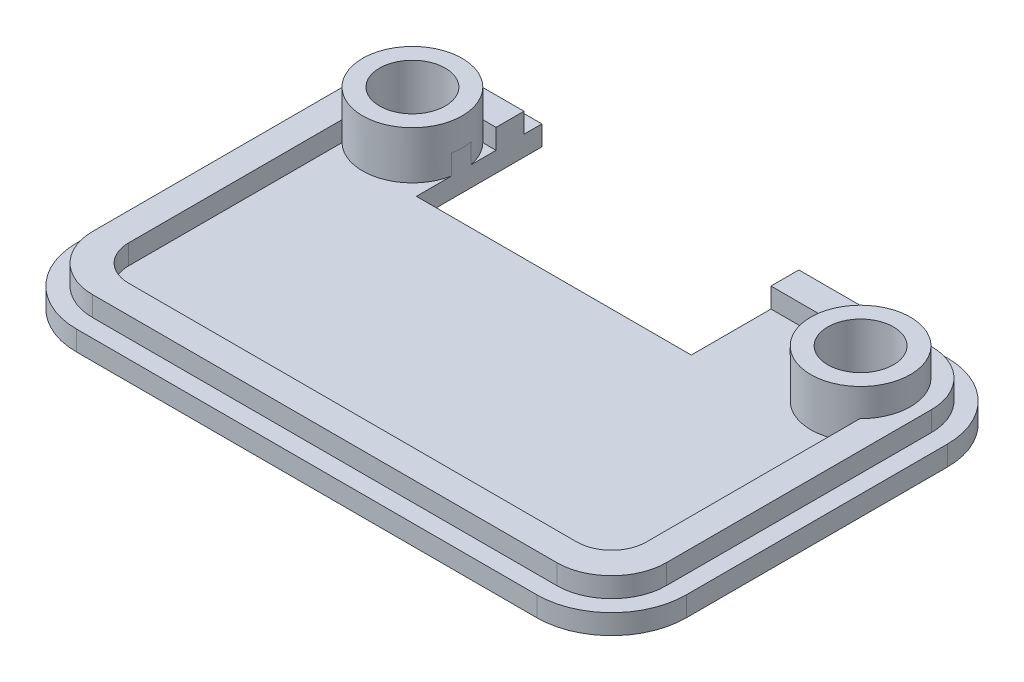
from build123d import *
from build123d.topology import SkipClean

# Parameters (mm, degrees)
SKETCH_1_W          = 30.6
SKETCH_1_H          = 20.6
EXTRUDE_1_DEPTH     = 1
SKETCH_2_W          = 28.8
SKETCH_2_H          = 18.8
SKETCH_2_W_2        = 26
SKETCH_2_H_2        = 16
EXTRUDE_2_DEPTH     = 1
SKETCH_3_R          = 2.5
SKETCH_3_R_2        = 1.65
EXTRUDE_3_DEPTH     = 2.4
FILLET_2_R          = 2.75
FILLET_3_R          = 3.75
FILLET_4_R          = 1.75
SKETCH_5_R          = 1.65
SKETCH_5_W          = 13.8
SKETCH_5_H          = 6.3
CUT_EXTRUDE_1_DEPTH = 2


with BuildPart() as part:
    # 草图1 → 凸台-拉伸1 (new body)
    with BuildSketch(Plane(origin=(0, 0, 0), x_dir=(1, 0, 0), z_dir=(0, 1, 0))):
        Rectangle(SKETCH_1_W, SKETCH_1_H)
    extrude(amount=EXTRUDE_1_DEPTH)

    # 草图2 → 凸台-拉伸2 (add)
    with BuildSketch(Plane(origin=(0, 1, 0), x_dir=(1, 0, 0), z_dir=(0, 1, 0))):
        Rectangle(SKETCH_2_W, SKETCH_2_H)
        Rectangle(SKETCH_2_W_2, SKETCH_2_H_2, mode=Mode.SUBTRACT)
    extrude(amount=EXTRUDE_2_DEPTH)

    # 草图3 → 凸台-拉伸3 (add)
    # profile 1 of 2: a face of its own
    with BuildSketch(Plane(origin=(0, 1, 0), x_dir=(1, 0, 0), z_dir=(0, 1, 0))):
        with Locations(Location((-11.25, 6.25, 0), (0, 0, 44.427004001))):
            Circle(SKETCH_3_R)
        with Locations(Location((-11.25, 6.25, 0), (0, 0, 270))):
            Circle(SKETCH_3_R_2, mode=Mode.SUBTRACT)
    # profile 2 of 2: a face of its own
    with BuildSketch(Plane(origin=(0, 1, 0), x_dir=(1, 0, 0), z_dir=(0, 1, 0))):
        with Locations(Location((11.25, 6.25, 0), (0, 0, 135.572995999))):
            Circle(SKETCH_3_R)
        with Locations(Location((11.25, 6.25, 0), (0, 0, 270))):
            Circle(SKETCH_3_R_2, mode=Mode.SUBTRACT)
    extrude(amount=EXTRUDE_3_DEPTH)

    # 圆角2
    fillet_2_edges = [part.edges().sort_by_distance(p)[0] for p in [
        (-14.4, 1.5, -9.4),
        (-14.4, 1.5, 9.4),
        (14.4, 1.5, 9.4),
        (14.4, 1.5, -9.4),
    ]]
    fillet(fillet_2_edges, radius=FILLET_2_R)

    # 圆角3
    fillet_3_edges = [part.edges().sort_by_distance(p)[0] for p in [
        (-15.3, 0.5, -10.3),
        (15.3, 0.5, -10.3),
        (15.3, 0.5, 10.3),
        (-15.3, 0.5, 10.3),
    ]]
    fillet(fillet_3_edges, radius=FILLET_3_R)

    # 圆角4
    fillet_4_edges = [part.edges().sort_by_distance(p)[0] for p in [
        (-13, 1.5, 8),
        (13, 1.5, 8),
    ]]
    fillet(fillet_4_edges, radius=FILLET_4_R)

    # 草图5 → 切除-拉伸1 (cut)
    with SkipClean():  # the faces are left unmerged after this step: merging them gives an invalid solid
        with BuildSketch(Plane.XZ):
            with Locations(Location((-11.25, -6.25, 0), (0, 0, 270))):
                Circle(SKETCH_5_R)
            with Locations(Location((11.25, -6.25, 0), (0, 0, 270))):
                Circle(SKETCH_5_R)
            with Locations((-1.9, -7.15)):
                Rectangle(SKETCH_5_W, SKETCH_5_H)
        extrude(amount=-CUT_EXTRUDE_1_DEPTH, mode=Mode.SUBTRACT)


solid = part.part
